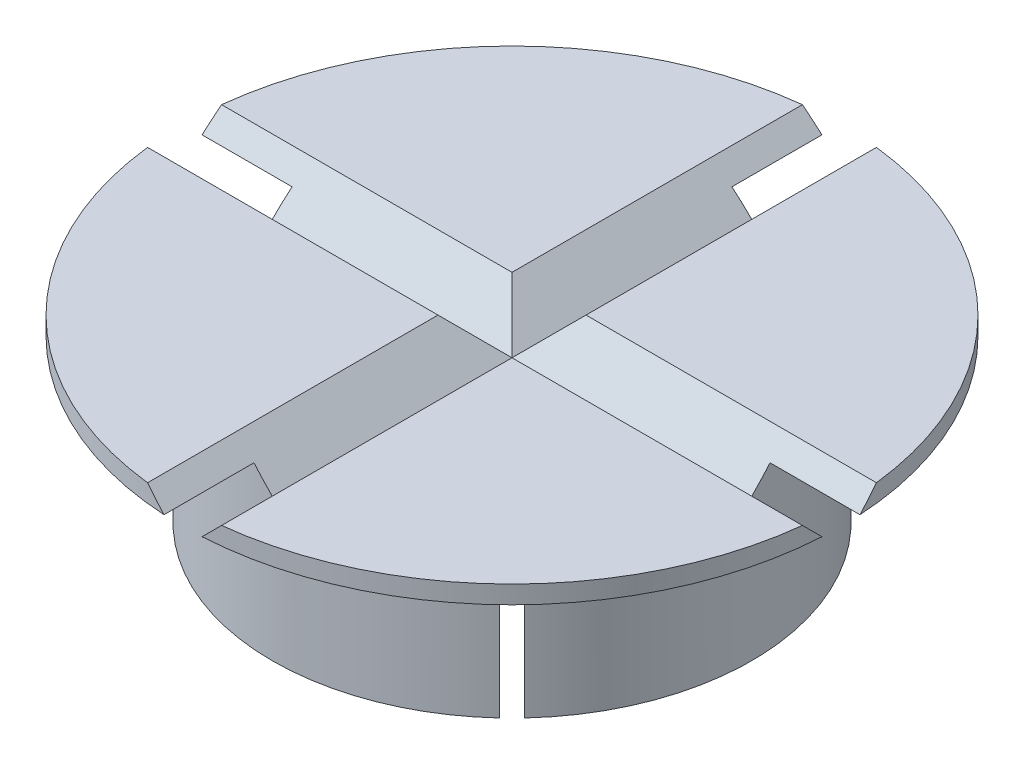
from build123d import *

# Parameters (mm, degrees)
CUT_EXTRUDE1_DEPTH = 56.621758333
CIRPATTERN1_COUNT  = 4
SKETCH3_R          = 23.75
CUT_EXTRUDE2_DEPTH = 12
CUT_EXTRUDE3_START = 12
CUT_EXTRUDE3_DEPTH = 12
CIRPATTERN2_COUNT  = 4


with BuildPart() as part:
    # Sketch1 → Revolve1 (revolve)
    with BuildSketch(Plane(origin=(0, 0, 0), x_dir=(0, 0, -1), z_dir=(1, 0, 0)), mode=Mode.PRIVATE) as revolve1_sk:
        Polygon((0, 0), (26.7, 0), (26.7, 18), (36.7, 18), (36.7, 20), (0, 20), align=None)
    revolve(revolve1_sk.sketch.rotate(Axis((0, 20, 0), (0, -1, 0)), 180), axis=Axis((0, 20, 0), (0, -1, 0)))

    # Sketch2 → Cut-Extrude1 (cut, symmetric)
    with BuildSketch(Plane.XY):
        Polygon((4.121320344, 20), (0, 15.878679656), (-4.121320344, 20), align=None)
    cut_extrude1 = extrude(amount=CUT_EXTRUDE1_DEPTH, both=True, mode=Mode.SUBTRACT)

    # CirPattern1: Cut-Extrude1 ×4 about axis
    cirpattern1_axis = Axis((0, 0, 0), (0, 1, 0))
    for i in range(1, CIRPATTERN1_COUNT):
        add(cut_extrude1.rotate(cirpattern1_axis, i * 360 / CIRPATTERN1_COUNT), mode=Mode.SUBTRACT)

    # Sketch3 → Cut-Extrude2 (cut)
    with BuildSketch(Plane.XZ):
        with Locations(Location((0, 0, 0), (0, 0, 270))):
            Circle(SKETCH3_R)
    extrude(amount=-CUT_EXTRUDE2_DEPTH, mode=Mode.SUBTRACT)

    # Sketch4 → Cut-Extrude3 (cut)
    with BuildSketch(Plane(origin=(0, 0, 0), x_dir=(1, 0, 0), z_dir=(0, 1, 0)).offset(CUT_EXTRUDE3_START)):
        with BuildLine():
            Line((-25.234076692, -26.648290255), (0, -1.414213562))
            Line((0, -1.414213562), (-1.414213562, 0))
            Line((-1.414213562, 0), (-26.648290255, -25.234076692))
            ThreePointArc((-26.648290255, -25.234076692), (-25.95081887, -25.95081887), (-25.234076692, -26.648290255))
        make_face()
    cut_extrude3 = extrude(amount=-CUT_EXTRUDE3_DEPTH, mode=Mode.SUBTRACT)

    # CirPattern2: Cut-Extrude3 ×4 about axis
    cirpattern2_axis = Axis((0, 0, 0), (0, 1, 0))
    for i in range(1, CIRPATTERN2_COUNT):
        add(cut_extrude3.rotate(cirpattern2_axis, i * 360 / CIRPATTERN2_COUNT), mode=Mode.SUBTRACT)


solid = part.part
